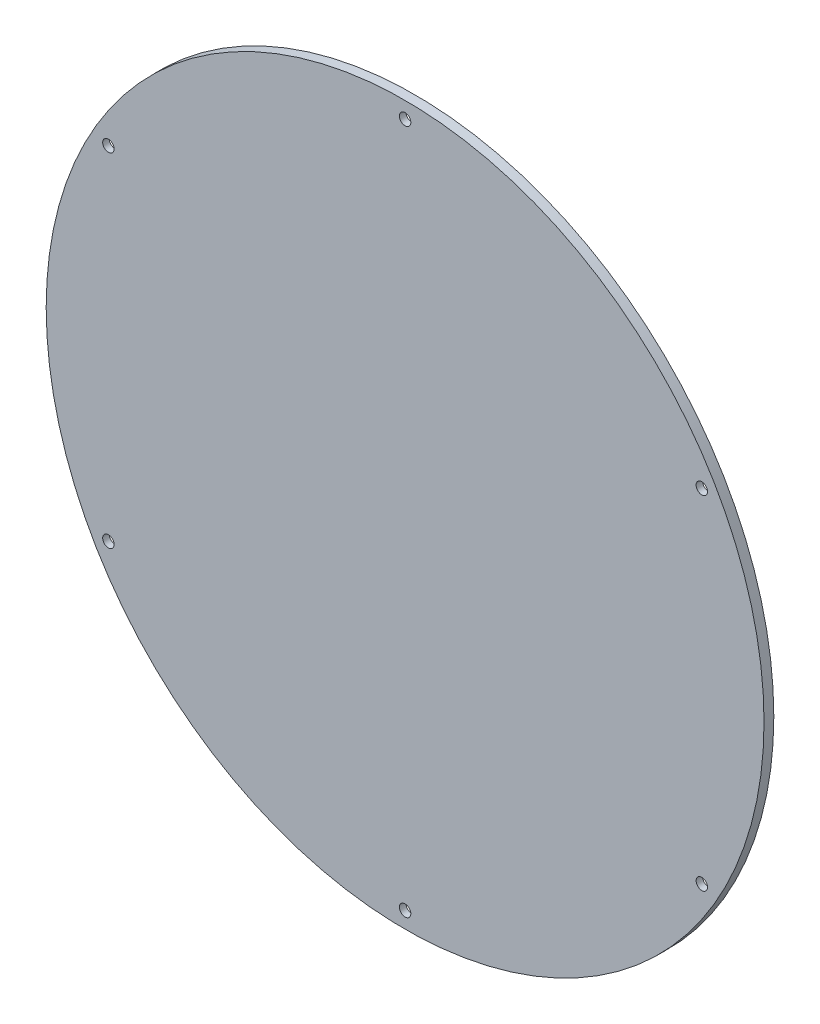
from build123d import *
from OCP.BRepFilletAPI import BRepFilletAPI_MakeChamfer

# Parameters (mm, degrees)
CROQUIS1_R              = 110
CROQUIS1_R_2            = 1.75
SALIENTE_EXTRUIR1_DEPTH = 3
CHAFL_N1_SIZE           = 1
CHAFL_N1_SIZE2          = 1.732050808
CHAFL_N2_SIZE           = 1
CHAFL_N2_SIZE2          = 1.732050808


with BuildPart() as part:
    # Croquis1 → Saliente-Extruir1 (new body)
    with BuildSketch(Plane.XY):
        Circle(CROQUIS1_R)
        with Locations((0, 105)):
            Circle(CROQUIS1_R_2, mode=Mode.SUBTRACT)
        with Locations((90.932667397, 52.5)):
            Circle(CROQUIS1_R_2, mode=Mode.SUBTRACT)
        with Locations((90.932667397, -52.5)):
            Circle(CROQUIS1_R_2, mode=Mode.SUBTRACT)
        with Locations((0, -105)):
            Circle(CROQUIS1_R_2, mode=Mode.SUBTRACT)
        with Locations((-90.932667397, -52.5)):
            Circle(CROQUIS1_R_2, mode=Mode.SUBTRACT)
        with Locations((-90.932667397, 52.5)):
            Circle(CROQUIS1_R_2, mode=Mode.SUBTRACT)
    extrude(amount=SALIENTE_EXTRUIR1_DEPTH)

    # Chaflán1
    chafl_n1_edges = [part.edges().sort_by_distance(p)[0] for p in [
        (-1.75, 105, 0),
    ]]
    chafl_n1_side = [part.faces().sort_by_distance(p)[0] for p in [
        (-1.75, 105, 1.5),
    ]]
    chamfer(chafl_n1_edges, length=CHAFL_N1_SIZE, length2=CHAFL_N1_SIZE2, reference=chafl_n1_side[0])

    # Chaflán2: one chamfer whose edges measure the first distance from different faces: ONE call of the kernel's chamfer builder (chamfer() names one face for all edges)
    chafl_n2_edges_1 = [part.edges().sort_by_distance(p)[0] for p in [
        (89.182667397, -52.5, 0),
    ]]
    chafl_n2_side_1 = [part.faces().sort_by_distance(p)[0] for p in [
        (89.182667397, -52.5, 1.5),
    ]]
    chafl_n2_edges_2 = [part.edges().sort_by_distance(p)[0] for p in [
        (-1.75, -105, 0),
    ]]
    chafl_n2_side_2 = [part.faces().sort_by_distance(p)[0] for p in [
        (-1.75, -105, 1.5),
    ]]
    chafl_n2_edges_3 = [part.edges().sort_by_distance(p)[0] for p in [
        (-92.682667397, -52.5, 0),
    ]]
    chafl_n2_side_3 = [part.faces().sort_by_distance(p)[0] for p in [
        (-92.682667397, -52.5, 1.5),
    ]]
    chafl_n2_edges_4 = [part.edges().sort_by_distance(p)[0] for p in [
        (-92.682667397, 52.5, 0),
    ]]
    chafl_n2_side_4 = [part.faces().sort_by_distance(p)[0] for p in [
        (-92.682667397, 52.5, 1.5),
    ]]
    chafl_n2_edges_5 = [part.edges().sort_by_distance(p)[0] for p in [
        (89.182667397, 52.5, 0),
    ]]
    chafl_n2_side_5 = [part.faces().sort_by_distance(p)[0] for p in [
        (89.182667397, 52.5, 1.5),
    ]]
    chafl_n2 = BRepFilletAPI_MakeChamfer(part.part.solid().wrapped)
    for e in chafl_n2_edges_1:
        chafl_n2.Add(CHAFL_N2_SIZE, CHAFL_N2_SIZE2, e.wrapped, chafl_n2_side_1[0].wrapped)  # the first distance lies on this face
    for e in chafl_n2_edges_2:
        chafl_n2.Add(CHAFL_N2_SIZE, CHAFL_N2_SIZE2, e.wrapped, chafl_n2_side_2[0].wrapped)  # the first distance lies on this face
    for e in chafl_n2_edges_3:
        chafl_n2.Add(CHAFL_N2_SIZE, CHAFL_N2_SIZE2, e.wrapped, chafl_n2_side_3[0].wrapped)  # the first distance lies on this face
    for e in chafl_n2_edges_4:
        chafl_n2.Add(CHAFL_N2_SIZE, CHAFL_N2_SIZE2, e.wrapped, chafl_n2_side_4[0].wrapped)  # the first distance lies on this face
    for e in chafl_n2_edges_5:
        chafl_n2.Add(CHAFL_N2_SIZE, CHAFL_N2_SIZE2, e.wrapped, chafl_n2_side_5[0].wrapped)  # the first distance lies on this face
    add(Compound.cast(chafl_n2.Shape()), mode=Mode.REPLACE)


solid = part.part
